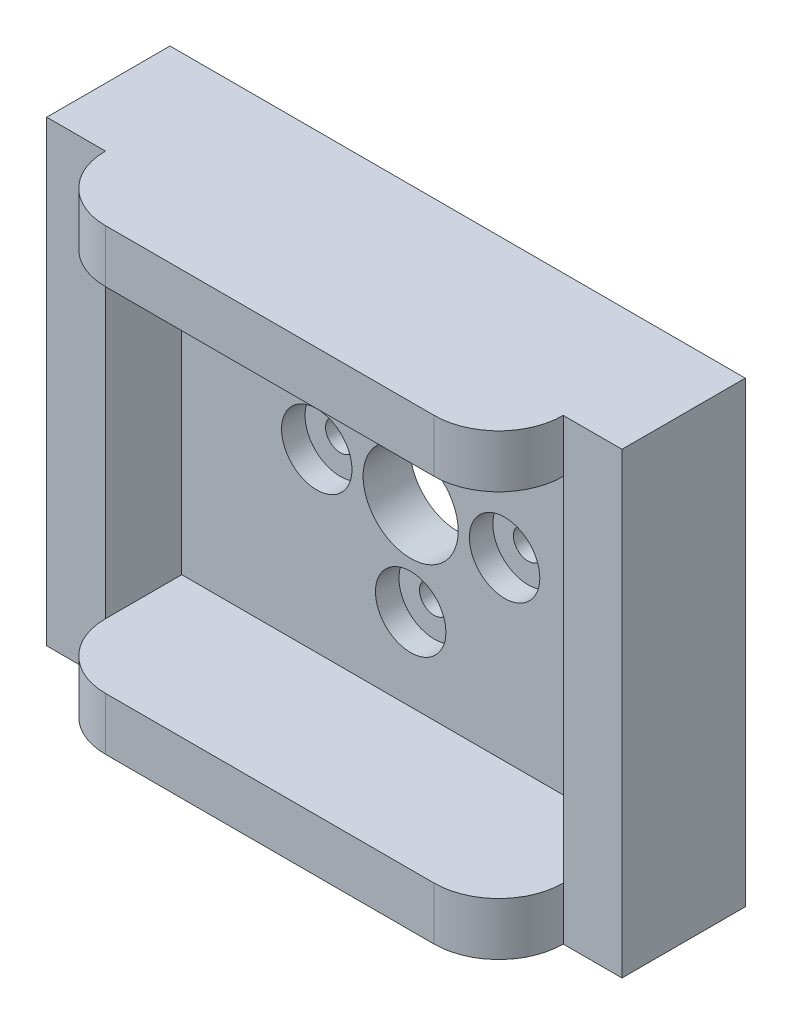
from build123d import *
from build123d.topology import SkipClean

# Parameters (mm, degrees)
SKETCH1_W            = 39
SKETCH1_H            = 23.712741858
BOSS_EXTRUDE1_DEPTH  = 2
SKETCH9_R            = 4.05
CUT_EXTRUDE6_DEPTH   = 5
SKETCH10_R           = 1.25
BOSS_EXTRUDE5_DEPTH  = 5.5
SKETCH11_R           = 2.5
CUT_EXTRUDE7_DEPTH   = 5
BOSS_EXTRUDE6_START  = -5.5
SKETCH12_R           = 2.5
BOSS_EXTRUDE6_DEPTH  = 5.5
BOSS_EXTRUDE7_DEPTH  = 28
BOSS_EXTRUDE8_START  = 2
SKETCH14_W           = 39
SKETCH14_H           = 29
SKETCH14_R           = 1.25
SKETCH14_R_2         = 4.05
BOSS_EXTRUDE8_DEPTH  = 2
SKETCH15_R           = 3
CUT_EXTRUDE8_DEPTH   = 2
BOSS_EXTRUDE9_DEPTH  = 5
BOSS_EXTRUDE10_START = 5
BOSS_EXTRUDE10_DEPTH = 5
CUT_EXTRUDE9_REACH   = 41.579
SKETCH18_W           = 39
SKETCH18_H           = 30
SKETCH19_W           = 10.5
SKETCH19_H           = 39
BOSS_EXTRUDE11_DEPTH = 5
SKETCH20_W           = 10.5
SKETCH20_H           = 39
BOSS_EXTRUDE12_DEPTH = 5


with BuildPart() as part:
    # Sketch1 → Boss-Extrude1 (new body)
    with BuildSketch(Plane.XY):
        with Locations((0, -11)):
            Rectangle(SKETCH1_W, SKETCH1_H)
        with BuildLine():
            ThreePointArc((1.25, -19), (0, -17.75), (-1.25, -19))
            ThreePointArc((-1.25, -19), (0, -20.25), (1.25, -19))
        make_face(mode=Mode.SUBTRACT)
        with BuildLine():
            ThreePointArc((-6.75, -11), (-8, -9.75), (-9.25, -11))
            ThreePointArc((-9.25, -11), (-8, -12.25), (-6.75, -11))
        make_face(mode=Mode.SUBTRACT)
        with BuildLine():
            ThreePointArc((1.25, -3), (0, -1.75), (-1.25, -3))
            ThreePointArc((-1.25, -3), (0, -4.25), (1.25, -3))
        make_face(mode=Mode.SUBTRACT)
        with BuildLine():
            ThreePointArc((9.25, -11), (8, -9.75), (6.75, -11))
            ThreePointArc((6.75, -11), (8, -12.25), (9.25, -11))
        make_face(mode=Mode.SUBTRACT)
    extrude(amount=BOSS_EXTRUDE1_DEPTH)

    # Sketch9 → Cut-Extrude6 (cut)
    with BuildSketch(Plane.XY.offset(2)):
        with Locations((0, -11)):
            Circle(SKETCH9_R)
    extrude(amount=-CUT_EXTRUDE6_DEPTH, mode=Mode.SUBTRACT)

    # Sketch10 → Boss-Extrude5 (add)
    # profile 1 of 2: a face of its own
    with BuildSketch(Plane.ZY.offset(19.5)):
        with BuildLine():
            Line((4.2, 3.5), (8.5, 3.5))
            Line((8.5, 3.5), (8.5, 0.5))
            ThreePointArc((8.5, 0.5), (7.474873734, -1.974873734), (5, -3))
            Line((5, -3), (2, -3))
            Line((2, -3), (2, 0.856370929))
            Line((2, 0.856370929), (0, 0.856370929))
            Line((0, 0.856370929), (0, 3.5))
            Line((0, 3.5), (4.2, 3.5))
        make_face()
        with Locations((5.25, 0.25)):
            Circle(SKETCH10_R, mode=Mode.SUBTRACT)
    # profile 2 of 2: a face of its own
    with BuildSketch(Plane.ZY.offset(19.5)):
        with BuildLine():
            Line((5, -19), (2, -19))
            Line((2, -19), (2, -22.856370929))
            Line((2, -22.856370929), (0, -22.856370929))
            Line((0, -22.856370929), (0, -25.5))
            Line((0, -25.5), (4.2, -25.5))
            Line((4.2, -25.5), (8.5, -25.5))
            Line((8.5, -25.5), (8.5, -22.5))
            ThreePointArc((8.5, -22.5), (7.474873734, -20.025126266), (5, -19))
        make_face()
        with Locations((5.25, -22.25)):
            Circle(SKETCH10_R, mode=Mode.SUBTRACT)
    extrude(amount=-BOSS_EXTRUDE5_DEPTH)

    # Sketch11 → Cut-Extrude7 (cut)
    with BuildSketch(Plane.ZY.offset(19.5)):
        with Locations((5.25, 0.25)):
            Circle(SKETCH11_R)
        with Locations(Location((5.25, -22.25, 0), (0, 0, 180))):
            Circle(SKETCH11_R)
    extrude(amount=-CUT_EXTRUDE7_DEPTH, mode=Mode.SUBTRACT)

    # Sketch12 → Boss-Extrude6 (add)
    with BuildSketch(Plane(origin=(19.5, 0, 0), x_dir=(0, 0, -1), z_dir=(1, 0, 0)).offset(BOSS_EXTRUDE6_START)):
        with BuildLine():
            ThreePointArc((-8.5, 0.5), (-7.474873734, -1.974873734), (-5, -3))
            Line((-5, -3), (-2, -3))
            Line((-2, -3), (-2, -19))
            Line((-2, -19), (-5, -19))
            ThreePointArc((-5, -19), (-7.474873734, -20.025126266), (-8.5, -22.5))
            Line((-8.5, -22.5), (-8.5, -25.5))
            Line((-8.5, -25.5), (0, -25.5))
            Line((0, -25.5), (0, 3.5))
            Line((0, 3.5), (-8.5, 3.5))
            Line((-8.5, 3.5), (-8.5, 0.5))
        make_face()
        with Locations((-5.25, -22.25)):
            Circle(SKETCH12_R, mode=Mode.SUBTRACT)
        with Locations(Location((-5.25, 0.25, 0), (0, 0, 180))):
            Circle(SKETCH12_R, mode=Mode.SUBTRACT)
    extrude(amount=BOSS_EXTRUDE6_DEPTH)

    # Sketch13 → Boss-Extrude7 (add)
    with BuildSketch(Plane.ZY.offset(-14)):
        Polygon((0, 3.5), (4.2, 3.5), (2, 1.3), (2, 0.856370929), (0, 0.856370929), align=None)
        Polygon((2, -22.856370929), (0, -22.856370929), (0, -25.5), (4.2, -25.5), (2, -23.3), align=None)
    extrude(amount=BOSS_EXTRUDE7_DEPTH)

    # Sketch14 → Boss-Extrude8 (add)
    with SkipClean():  # the faces are left unmerged after this step: merging them gives an invalid solid
        with BuildSketch(Plane(origin=(0, 0, 0), x_dir=(-1, 0, 0), z_dir=(0, 0, -1)).offset(BOSS_EXTRUDE8_START)):
            with Locations((0, -11)):
                Rectangle(SKETCH14_W, SKETCH14_H)
            with Locations((0, -19)):
                Circle(SKETCH14_R, mode=Mode.SUBTRACT)
            with Locations((8, -11)):
                Circle(SKETCH14_R, mode=Mode.SUBTRACT)
            with Locations((0, -3)):
                Circle(SKETCH14_R, mode=Mode.SUBTRACT)
            with Locations(Location((0, -11, 0), (0, 0, 180))):
                Circle(SKETCH14_R_2, mode=Mode.SUBTRACT)
            with Locations((-8, -11)):
                Circle(SKETCH14_R, mode=Mode.SUBTRACT)
        extrude(amount=-BOSS_EXTRUDE8_DEPTH)

    # Sketch15 → Cut-Extrude8 (cut)
    with BuildSketch(Plane.XY.offset(2)):
        with Locations((0, -3)):
            Circle(SKETCH15_R)
        with Locations((8, -11)):
            Circle(SKETCH15_R)
        with Locations((0, -19)):
            Circle(SKETCH15_R)
        with Locations((-8, -11)):
            Circle(SKETCH15_R)
    extrude(amount=-CUT_EXTRUDE8_DEPTH, mode=Mode.SUBTRACT)

    # Sketch16 → Boss-Extrude9 (add)
    with BuildSketch(Plane(origin=(0, 3.5, 0), x_dir=(1, 0, 0), z_dir=(0, 1, 0))):
        with BuildLine():
            ThreePointArc((-19.5, -8.5), (-17.889087297, -12.389087297), (-14, -14))
            Line((-14, -14), (14, -14))
            ThreePointArc((14, -14), (17.889087297, -12.389087297), (19.5, -8.5))
            Line((19.5, -8.5), (14, -8.5))
            Line((14, -8.5), (14, -4.2))
            Line((14, -4.2), (-14, -4.2))
            Line((-14, -4.2), (-14, -8.5))
            Line((-14, -8.5), (-19.5, -8.5))
        make_face()
        Polygon((-19.5, -8.5), (-14, -8.5), (-14, -4.2), (14, -4.2), (14, -8.5), (19.5, -8.5), (19.5, 2), (-19.5, 2), align=None)
    extrude(amount=BOSS_EXTRUDE9_DEPTH)

    # Sketch17 → Boss-Extrude10 (add)
    with BuildSketch(Plane.XZ.offset(25.5).offset(BOSS_EXTRUDE10_START)):
        with BuildLine():
            Line((19.5, -2), (19.5, 8.5))
            ThreePointArc((19.5, 8.5), (17.889087297, 12.389087297), (14, 14))
            Line((14, 14), (-14, 14))
            ThreePointArc((-14, 14), (-17.889087297, 12.389087297), (-19.5, 8.5))
            Line((-19.5, 8.5), (-19.5, -2))
            Line((-19.5, -2), (19.5, -2))
        make_face()
    extrude(amount=-BOSS_EXTRUDE10_DEPTH)

    # Cut-Extrude9: up to this face of the body (flat: up to its plane)
    cut_extrude9_end = Plane(part.part.faces().sort_by_distance((16.75, -3.461103025, 2))[0])
    # Sketch18 → Cut-Extrude9 (cut, up to the picked face)
    with BuildSketch(Plane.XY.offset(14), mode=Mode.PRIVATE) as cut_extrude9_sk1:
        with Locations((0, -11)):
            Rectangle(SKETCH18_W, SKETCH18_H)
    cut_extrude9_tool1 = split(extrude(cut_extrude9_sk1.sketch, amount=-CUT_EXTRUDE9_REACH, mode=Mode.PRIVATE), bisect_by=cut_extrude9_end, keep=Keep.BOTH, mode=Mode.PRIVATE)
    add(cut_extrude9_tool1.solids().sort_by(Axis((0, -11, 14), (0, 0, -1)))[0], mode=Mode.SUBTRACT)

    # Sketch19 → Boss-Extrude11 (add)
    with BuildSketch(Plane.ZY.offset(19.5)):
        with Locations((3.25, -11)):
            Rectangle(SKETCH19_W, SKETCH19_H)
    extrude(amount=BOSS_EXTRUDE11_DEPTH)

    # Sketch20 → Boss-Extrude12 (add)
    with BuildSketch(Plane(origin=(19.5, 0, 0), x_dir=(0, 0, -1), z_dir=(1, 0, 0))):
        with Locations((-3.25, -11)):
            Rectangle(SKETCH20_W, SKETCH20_H)
    extrude(amount=BOSS_EXTRUDE12_DEPTH)


solid = part.part
